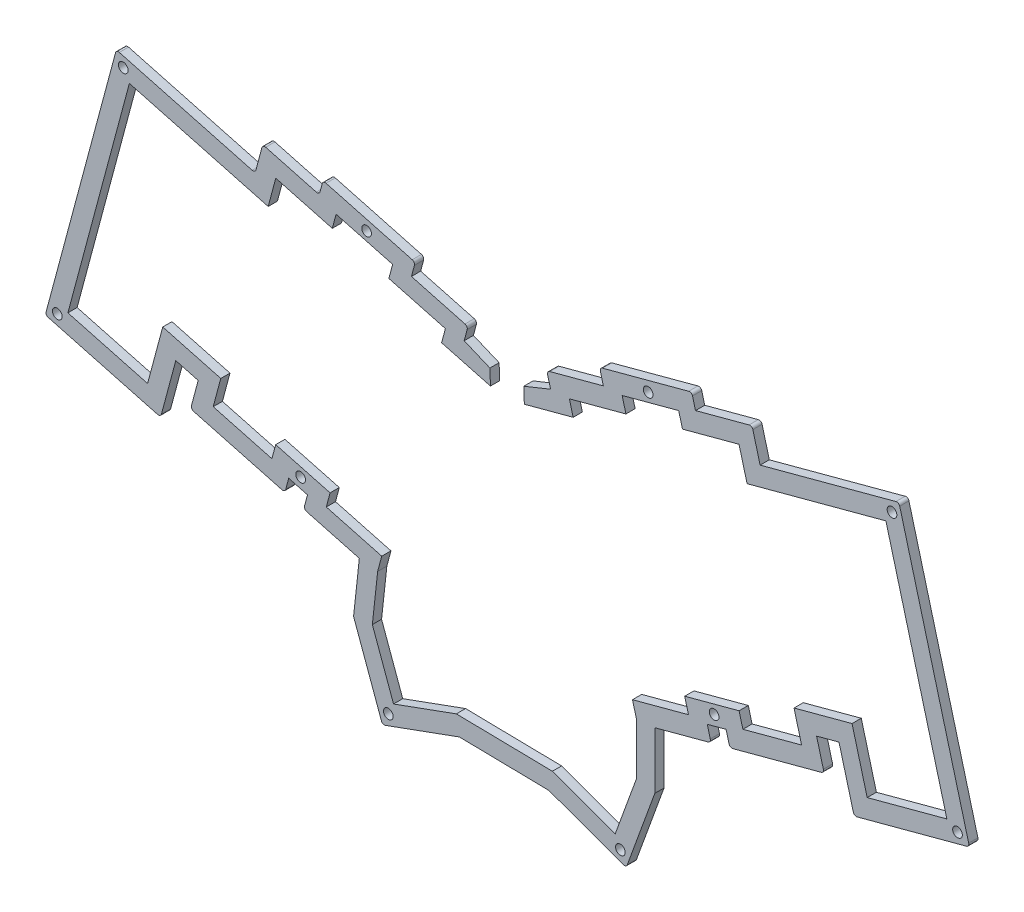
from build123d import *

# Parameters (mm, degrees)
MODEL_R             = 1.575
BOSS_EXTRUDE1_DEPTH = 3
FILLET1_R           = 1


with BuildPart() as part:
    # Model → Boss-Extrude1 (new body)
    with BuildSketch(Plane.XY):
        Polygon((271.203498451, 292.223209107), (291.05122826, 218.15247975), (265.115556398, 211.204247731), (260.186189629, 229.604099473), (241.30271159, 224.544411578), (243.767491017, 215.34412721), (224.664804007, 210.226469096), (223.432328054, 214.825649934), (205.733277658, 210.084029615), (206.966112962, 205.483507804), (188.744476932, 200.600523414), (190.038361872, 195.770837942), (190.009613349, 178.903688177), (183.116533861, 159.968814913), (162.674398087, 167.40803076), (131.428930231, 167.95289908), (110.986427135, 160.514692668), (104.096364698, 179.45072575), (105.814746135, 195.273012707), (107.149713912, 200.256048118), (89.106877808, 205.089769496), (90.339405557, 209.690426923), (72.639899407, 214.432169339), (71.407895987, 209.833469074), (52.305208977, 214.951127188), (54.770081908, 224.151554257), (35.886712889, 229.210569975), (30.957132238, 210.811459981), (5.0216469, 217.76022363), (25.028202346, 292.426367848), (70.198239559, 280.323200295), (72.663861356, 289.523562363), (91.063082461, 284.591613875), (92.29653696, 289.193676092), (110.695758065, 284.261727603), (109.463398178, 279.663749421), (127.862619282, 274.731800932), (126.630323598, 270.134062294), (142.522359716, 265.874644989), (142.344694619, 270.871486432), (133.979081507, 274.376202933), (135.211333861, 278.973779905), (116.812112756, 283.905728394), (118.044472643, 288.503706576), (88.054439652, 296.542595671), (86.820985153, 291.940533454), (68.42160019, 296.872525865), (65.955825932, 287.671594898), (20.785545351, 299.774827661), (-2.32684459, 213.517448416), (35.199939127, 203.463086712), (40.129543563, 221.862285479), (47.421773629, 219.90863481), (44.956891994, 210.708175253), (75.650856625, 202.485184579), (76.882860045, 207.083884844), (82.991121062, 205.447466285), (81.758593313, 200.846808858), (99.858189105, 195.997881416), (97.980730454, 178.710864183), (107.399642776, 152.824765622), (132.435827139, 161.934428279), (161.565977706, 161.426447529), (186.702312667, 152.27893851), (196.007810089, 177.840578221), (196.039346948, 196.343682115), (214.314693354, 201.241059665), (213.081966369, 205.841177268), (219.189771603, 207.477473721), (220.422247557, 202.878292884), (251.115775513, 211.101166572), (248.650938057, 220.301667543), (255.943287021, 222.255598366), (260.87259576, 203.855963236), (298.39980436, 213.909597233), (275.446186014, 299.571346393), (230.276304619, 287.470798216), (227.65276755, 297.263677376), (209.252454514, 292.334187025), (208.019481767, 296.93522173), (178.028627015, 288.898354165), (179.260689602, 284.297666211), (160.85900272, 279.367807803), (162.091473536, 274.767362889), (153.371764929, 271.263453794), (153.549484965, 266.266603363), (169.439649748, 270.524806438), (168.207287216, 275.124847165), (186.60841776, 280.054556529), (185.376246939, 284.655648642), (203.777033628, 289.586641337), (205.009898064, 284.986010813), (223.409806911, 289.915392881), (226.033325469, 280.122582817), align=None)
        with Locations((23.035554, 295.877718337)):
            Circle(MODEL_R, mode=Mode.SUBTRACT)
        with Locations((109.301822433, 156.902965293)):
            Circle(MODEL_R, mode=Mode.SUBTRACT)
        with Locations((184.800560745, 156.35733766)):
            Circle(MODEL_R, mode=Mode.SUBTRACT)
        with Locations((193.847437398, 289.84318413)):
            Circle(MODEL_R, mode=Mode.SUBTRACT)
        with Locations((102.225689846, 289.449650012)):
            Circle(MODEL_R, mode=Mode.SUBTRACT)
        with Locations((273.19609114, 295.674286852)):
            Circle(MODEL_R, mode=Mode.SUBTRACT)
        with Locations((1.570241786, 215.767496811)):
            Circle(MODEL_R, mode=Mode.SUBTRACT)
        with Locations((294.502731407, 216.159668876)):
            Circle(MODEL_R, mode=Mode.SUBTRACT)
        with Locations((80.760413887, 209.339268578)):
            Circle(MODEL_R, mode=Mode.SUBTRACT)
        with Locations((215.312231294, 209.732861073)):
            Circle(MODEL_R, mode=Mode.SUBTRACT)
    extrude(amount=-BOSS_EXTRUDE1_DEPTH)

    # Fillet1
    fillet1_edges = [part.edges().sort_by_distance(p)[0] for p in [
        (160.85900272, 279.367807803, -1.5),
        (178.028627015, 288.898354165, -1.5),
        (208.019481767, 296.93522173, -1.5),
        (227.65276755, 297.263677376, -1.5),
        (275.446186014, 299.571346393, -1.5),
        (298.39980436, 213.909597233, -1.5),
        (260.87259576, 203.855963236, -1.5),
        (251.115775513, 211.101166572, -1.5),
        (220.422247557, 202.878292884, -1.5),
        (214.314693354, 201.241059665, -1.5),
        (186.702312667, 152.27893851, -1.5),
        (107.399642776, 152.824765622, -1.5),
        (81.758593313, 200.846808858, -1.5),
        (75.650856625, 202.485184579, -1.5),
        (44.956891994, 210.708175253, -1.5),
        (35.199939127, 203.463086712, -1.5),
        (-2.32684459, 213.517448416, -1.5),
        (20.785545351, 299.774827661, -1.5),
        (65.955825932, 287.671594898, -1.5),
        (68.42160019, 296.872525865, -1.5),
        (86.820985153, 291.940533454, -1.5),
        (88.054439652, 296.542595671, -1.5),
        (118.044472643, 288.503706576, -1.5),
        (135.211333861, 278.973779905, -1.5),
    ]]
    fillet(fillet1_edges, radius=FILLET1_R)


solid = part.part
